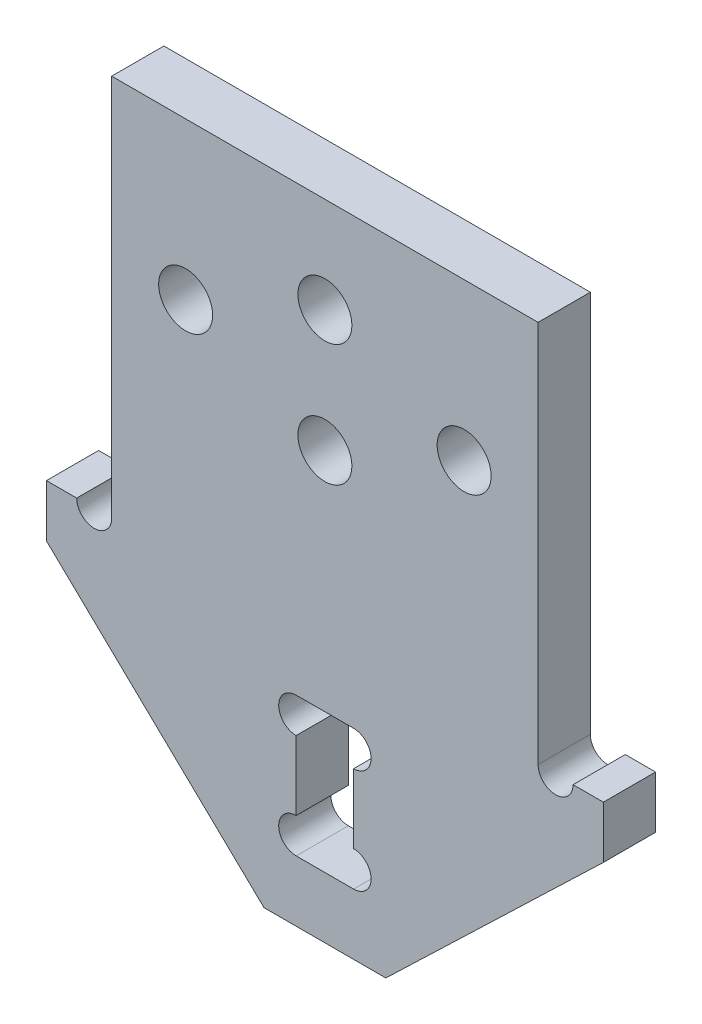
from build123d import *

# Parameters (mm, degrees)
SKETCH_1_R      = 1.55
EXTRUDE_1_DEPTH = 3


with BuildPart() as part:
    # 草图1 → 凸台-拉伸1 (new body)
    with BuildSketch(Plane.XY):
        with BuildLine():
            Line((-12.25, 11), (-12.25, -11))
            ThreePointArc((-12.25, -11), (-13.255, -12.005), (-14.26, -11))
            Line((-14.26, -11), (-16, -11))
            Line((-16, -11), (-16, -14))
            Line((-16, -14), (-3.5, -26))
            Line((-3.5, -26), (3.5, -26))
            Line((3.5, -26), (16, -14))
            Line((16, -14), (16, -11))
            Line((16, -11), (14.26, -11))
            ThreePointArc((14.26, -11), (13.255, -12.005), (12.25, -11))
            Line((12.25, -11), (12.25, 11))
            Line((12.25, 11), (-12.25, 11))
        make_face()
        with BuildLine():
            ThreePointArc((2.655, -21.495), (2.360642315, -22.205642315), (1.65, -22.5))
            Line((1.65, -22.5), (-1.65, -22.5))
            ThreePointArc((-1.65, -22.5), (-2.655, -21.495), (-1.65, -20.49))
            Line((-1.65, -20.49), (-1.65, -16.51))
            ThreePointArc((-1.65, -16.51), (-2.655, -15.505), (-1.65, -14.5))
            Line((-1.65, -14.5), (1.65, -14.5))
            ThreePointArc((1.65, -14.5), (2.360642315, -14.794357685), (2.655, -15.505))
            ThreePointArc((2.655, -15.505), (2.360642315, -16.215642315), (1.65, -16.51))
            Line((1.65, -16.51), (1.65, -20.49))
            ThreePointArc((1.65, -20.49), (2.360642315, -20.784357685), (2.655, -21.495))
        make_face(mode=Mode.SUBTRACT)
        with Locations((-8, 2)):
            Circle(SKETCH_1_R, mode=Mode.SUBTRACT)
        with Locations((0, -1.5)):
            Circle(SKETCH_1_R, mode=Mode.SUBTRACT)
        with Locations((0, 5.5)):
            Circle(SKETCH_1_R, mode=Mode.SUBTRACT)
        with Locations((8, 2)):
            Circle(SKETCH_1_R, mode=Mode.SUBTRACT)
    extrude(amount=EXTRUDE_1_DEPTH)


solid = part.part
